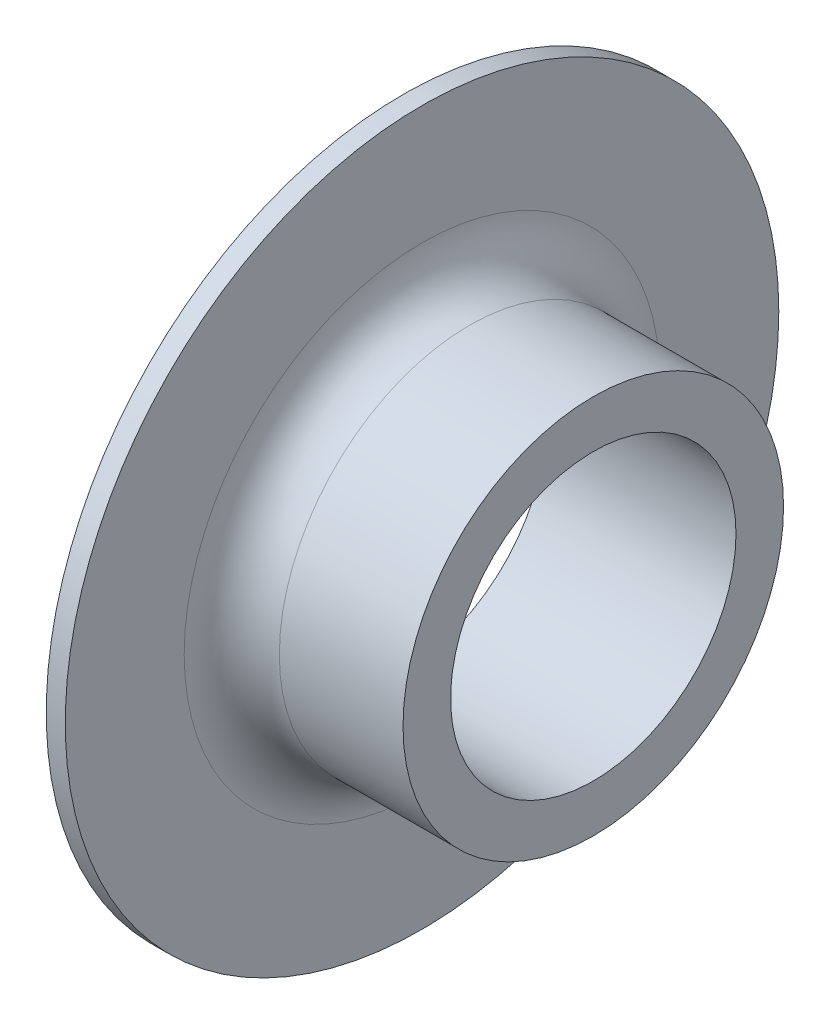
from build123d import *

# Parameters (mm, degrees)
FILLET1_R = 5


with BuildPart() as part:
    # Sketch2 → Revolve1 (revolve)
    with BuildSketch(Plane.XY, mode=Mode.PRIVATE) as revolve1_sk:
        Polygon((13.959126053, 37.5), (15.959126053, 37.5), (15.959126053, 20), (33.959126053, 20), (33.959126053, 15), (13.959126053, 15), align=None)
    revolve(revolve1_sk.sketch.rotate(Axis((66.86585888, 0, 0), (-1, 0, 0)), 90), axis=Axis((66.86585888, 0, 0), (-1, 0, 0)))

    # Fillet1
    fillet1_edges = [part.edges().sort_by_distance(p)[0] for p in [
        (15.959126053, 0, 20),
    ]]
    fillet(fillet1_edges, radius=FILLET1_R)


solid = part.part
